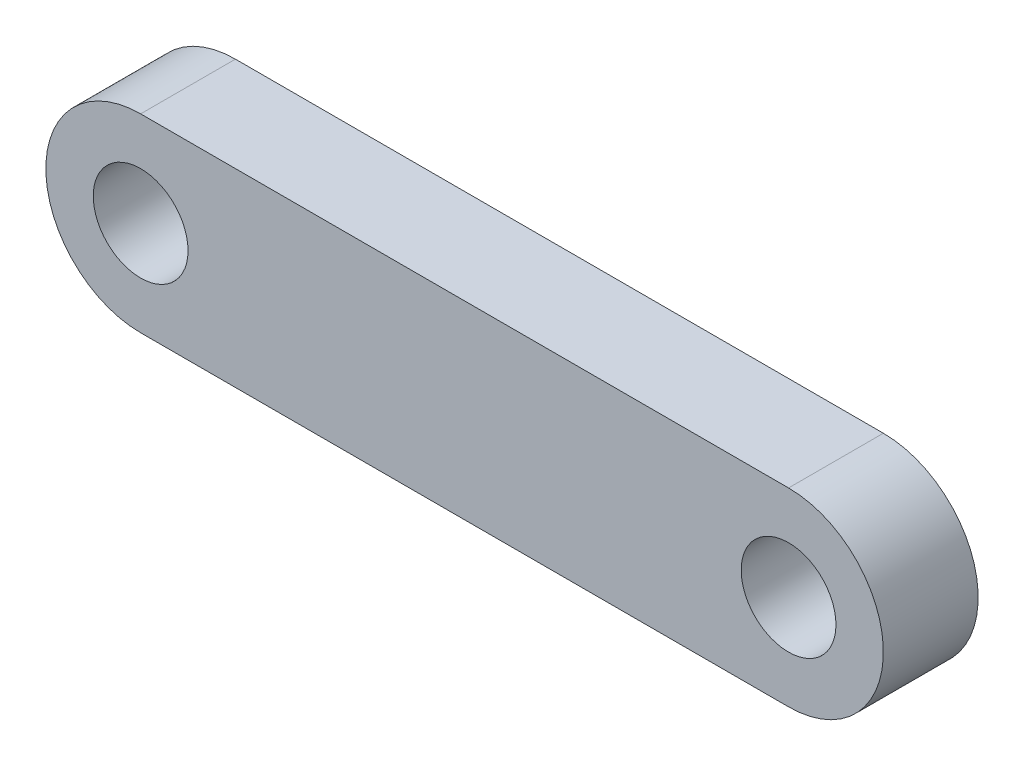
from build123d import *

# Parameters (mm, degrees)
EXTRUDE_1_DEPTH     = 10
SKETCH_2_R          = 5
CUT_EXTRUDE_1_DEPTH = 10
SKETCH_3_R          = 5
CUT_EXTRUDE_2_DEPTH = 10


with BuildPart() as part:
    # 草图1 → 凸台-拉伸1 (new body)
    with BuildSketch(Plane.XY):
        with BuildLine():
            Line((0, -10), (68.35, -10))
            ThreePointArc((68.35, -10), (78.35, 0), (68.35, 10))
            Line((68.35, 10), (0, 10))
            ThreePointArc((0, 10), (-10, 0), (0, -10))
        make_face()
    extrude(amount=EXTRUDE_1_DEPTH)

    # 草图2 → 切除-拉伸1 (cut)
    with BuildSketch(Plane.XY.offset(10)):
        Circle(SKETCH_2_R)
    extrude(amount=-CUT_EXTRUDE_1_DEPTH, mode=Mode.SUBTRACT)

    # 草图3 → 切除-拉伸2 (cut)
    with BuildSketch(Plane.XY.offset(10)):
        with Locations((68.35, 0)):
            Circle(SKETCH_3_R)
    extrude(amount=-CUT_EXTRUDE_2_DEPTH, mode=Mode.SUBTRACT)


solid = part.part
